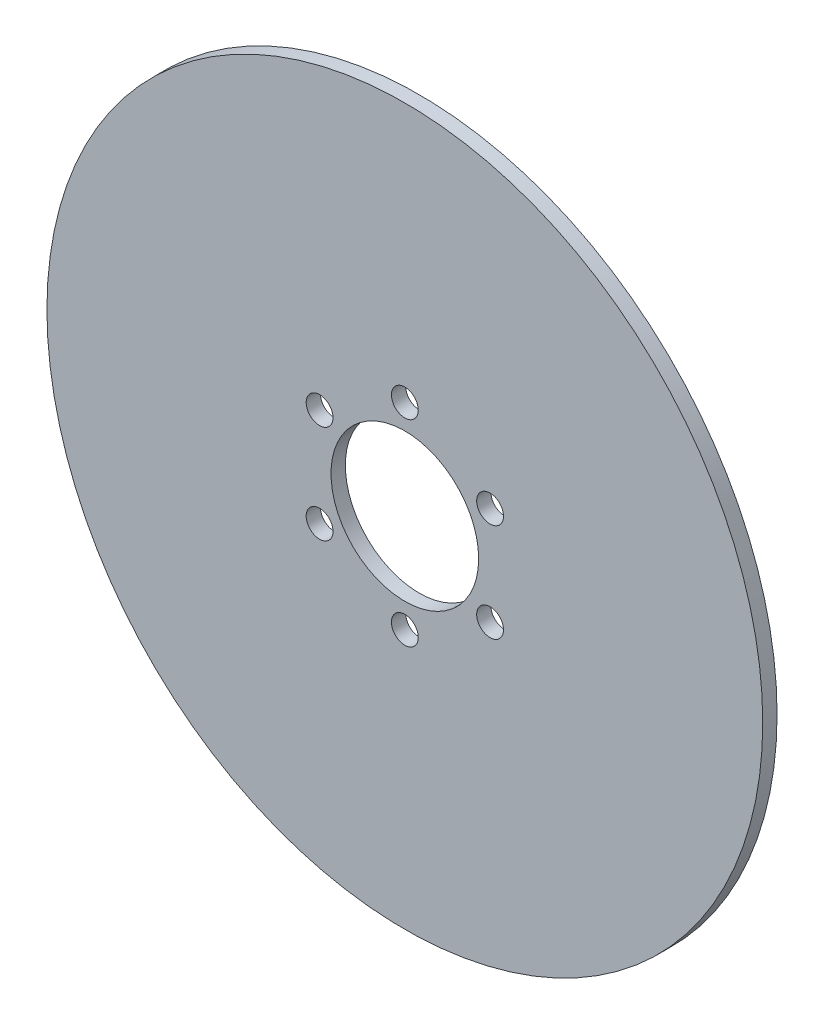
from build123d import *

# Parameters (mm, degrees)
ESQUISSE1_R        = 80
ESQUISSE1_R_2      = 3
ESQUISSE1_R_3      = 16.5
ESQUISSE1_R_4      = 10
BOSS_EXTRU_1_DEPTH = 3.2
BOSS_EXTRU_2_START = -0.2
ESQUISSE2_R        = 80
ESQUISSE2_R_2      = 53.253598624
BOSS_EXTRU_2_DEPTH = 0.2


with BuildPart() as part:
    # Esquisse1 → Boss.-Extru.1 (new body)
    with BuildSketch(Plane.XY):
        Circle(ESQUISSE1_R)
        with Locations((0, 22)):
            Circle(ESQUISSE1_R_2, mode=Mode.SUBTRACT)
        Circle(ESQUISSE1_R_3, mode=Mode.SUBTRACT)
        with Locations((19.052558883, 11)):
            Circle(ESQUISSE1_R_2, mode=Mode.SUBTRACT)
        with Locations((19.052558883, -11)):
            Circle(ESQUISSE1_R_2, mode=Mode.SUBTRACT)
        with Locations((0, -22)):
            Circle(ESQUISSE1_R_2, mode=Mode.SUBTRACT)
        with Locations((-19.052558883, -11)):
            Circle(ESQUISSE1_R_2, mode=Mode.SUBTRACT)
        with Locations((-19.052558883, 11)):
            Circle(ESQUISSE1_R_2, mode=Mode.SUBTRACT)
        with Locations((0, 68)):
            Circle(ESQUISSE1_R_4, mode=Mode.SUBTRACT)
        with Locations((26.022473401, 62.823808211)):
            Circle(ESQUISSE1_R_4, mode=Mode.SUBTRACT)
        with Locations((48.083261121, 48.083261121)):
            Circle(ESQUISSE1_R_4, mode=Mode.SUBTRACT)
        with Locations((62.823808211, 26.022473401)):
            Circle(ESQUISSE1_R_4, mode=Mode.SUBTRACT)
        with Locations((68, 0)):
            Circle(ESQUISSE1_R_4, mode=Mode.SUBTRACT)
        with Locations((62.823808211, -26.022473401)):
            Circle(ESQUISSE1_R_4, mode=Mode.SUBTRACT)
        with Locations((48.083261121, -48.083261121)):
            Circle(ESQUISSE1_R_4, mode=Mode.SUBTRACT)
        with Locations((26.022473401, -62.823808211)):
            Circle(ESQUISSE1_R_4, mode=Mode.SUBTRACT)
        with Locations((0, -68)):
            Circle(ESQUISSE1_R_4, mode=Mode.SUBTRACT)
        with Locations((-26.022473401, -62.823808211)):
            Circle(ESQUISSE1_R_4, mode=Mode.SUBTRACT)
        with Locations((-48.083261121, -48.083261121)):
            Circle(ESQUISSE1_R_4, mode=Mode.SUBTRACT)
        with Locations((-62.823808211, -26.022473401)):
            Circle(ESQUISSE1_R_4, mode=Mode.SUBTRACT)
        with Locations((-68, 0)):
            Circle(ESQUISSE1_R_4, mode=Mode.SUBTRACT)
        with Locations((-62.823808211, 26.022473401)):
            Circle(ESQUISSE1_R_4, mode=Mode.SUBTRACT)
        with Locations((-48.083261121, 48.083261121)):
            Circle(ESQUISSE1_R_4, mode=Mode.SUBTRACT)
        with Locations((-26.022473401, 62.823808211)):
            Circle(ESQUISSE1_R_4, mode=Mode.SUBTRACT)
    extrude(amount=BOSS_EXTRU_1_DEPTH)

    # Esquisse2 → Boss.-Extru.2 (add)
    with BuildSketch(Plane.XY.offset(3.2).offset(BOSS_EXTRU_2_START)):
        Circle(ESQUISSE2_R)
        Circle(ESQUISSE2_R_2, mode=Mode.SUBTRACT)
    extrude(amount=BOSS_EXTRU_2_DEPTH)


solid = part.part
